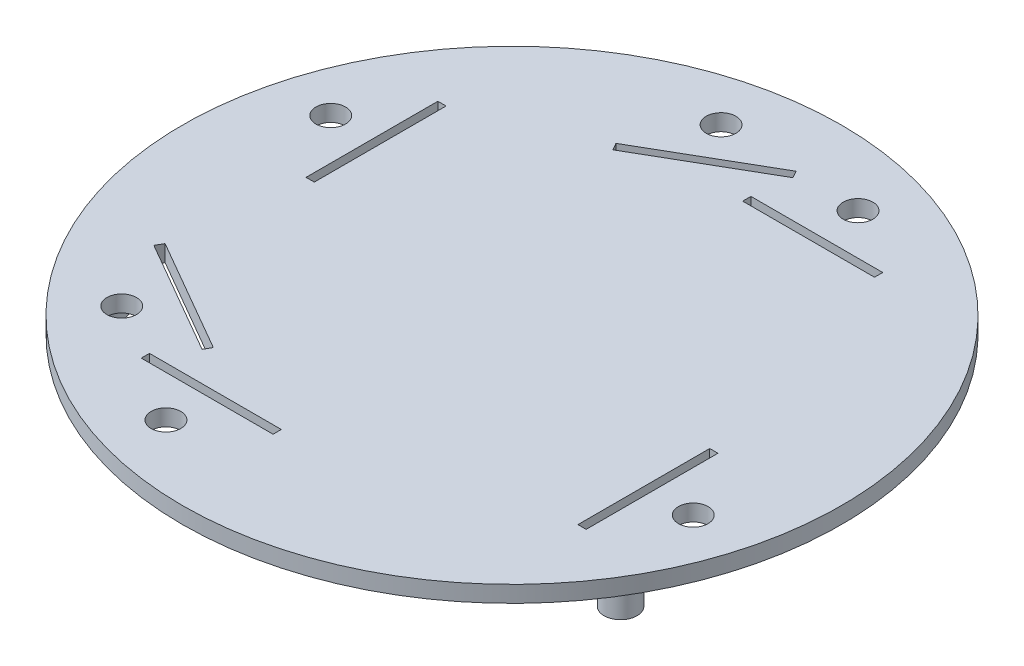
from build123d import *

# Parameters (mm, degrees)
SKETCH1_R           = 127
BOSS_EXTRUDE1_DEPTH = 6.35
SKETCH2_R           = 6.35
BOSS_EXTRUDE2_DEPTH = 12.7
SKETCH3_R           = 5.715
SKETCH3_W           = 50.8
SKETCH3_H           = 3.175
SKETCH3_W_2         = 3.175
SKETCH3_H_2         = 50.8
CUT_EXTRUDE1_DEPTH  = 181.612575697


with BuildPart() as part:
    # Sketch1 → Boss-Extrude1 (new body)
    with BuildSketch(Plane(origin=(0, 0, 0), x_dir=(1, 0, 0), z_dir=(0, 1, 0))):
        with Locations(Location((0, 0, 0), (0, 0, 270))):
            Circle(SKETCH1_R)
    extrude(amount=BOSS_EXTRUDE1_DEPTH)

    # Sketch2 → Boss-Extrude2 (add)
    with BuildSketch(Plane.XZ):
        with Locations(Location((0, -114.3, 0), (0, 0, 90))):
            Circle(SKETCH2_R)
        with Locations(Location((-98.986703653, 57.15, 0), (0, 0, 90))):
            Circle(SKETCH2_R)
        with Locations(Location((98.986703653, 57.15, 0), (0, 0, 90))):
            Circle(SKETCH2_R)
    extrude(amount=BOSS_EXTRUDE2_DEPTH)

    # Sketch3 → Cut-Extrude1 (cut, through all)
    with BuildSketch(Plane(origin=(0, 6.35, 0), x_dir=(1, 0, 0), z_dir=(0, 1, 0))):
        with Locations(Location((101.6, -31.75, 0), (0, 0, 270))):
            Circle(SKETCH3_R)
        with Locations(Location((-31.75, -101.6, 0), (0, 0, 270))):
            Circle(SKETCH3_R)
        with Locations(Location((-101.6, 31.75, 0), (0, 0, 270))):
            Circle(SKETCH3_R)
        with Locations(Location((31.75, 101.6, 0), (0, 0, 270))):
            Circle(SKETCH3_R)
        with Locations(Location((-78.29630657, -72.113181024, 0), (0, 0, 270))):
            Circle(SKETCH3_R)
        with Locations(Location((-23.30369343, 103.863181024, 0), (0, 0, 270))):
            Circle(SKETCH3_R)
        with Locations((-31.75, -84.1375)):
            Rectangle(SKETCH3_W, SKETCH3_H)
        with Locations((84.1375, -31.75)):
            Rectangle(SKETCH3_W_2, SKETCH3_H_2)
        with Locations((-84.1375, 31.75)):
            Rectangle(SKETCH3_W_2, SKETCH3_H_2)
        with Locations((31.75, 84.1375)):
            Rectangle(SKETCH3_W, SKETCH3_H)
        Polygon((-48.361761314, -71.065027739), (-92.355851826, -45.665027739), (-90.768351826, -42.915397082), (-46.774261314, -68.315397082), align=None)
        Polygon((-37.363238686, 77.415027739), (6.630851826, 102.815027739), (8.218351826, 100.065397082), (-35.775738686, 74.665397082), align=None)
    extrude(amount=-CUT_EXTRUDE1_DEPTH, mode=Mode.SUBTRACT)


solid = part.part
